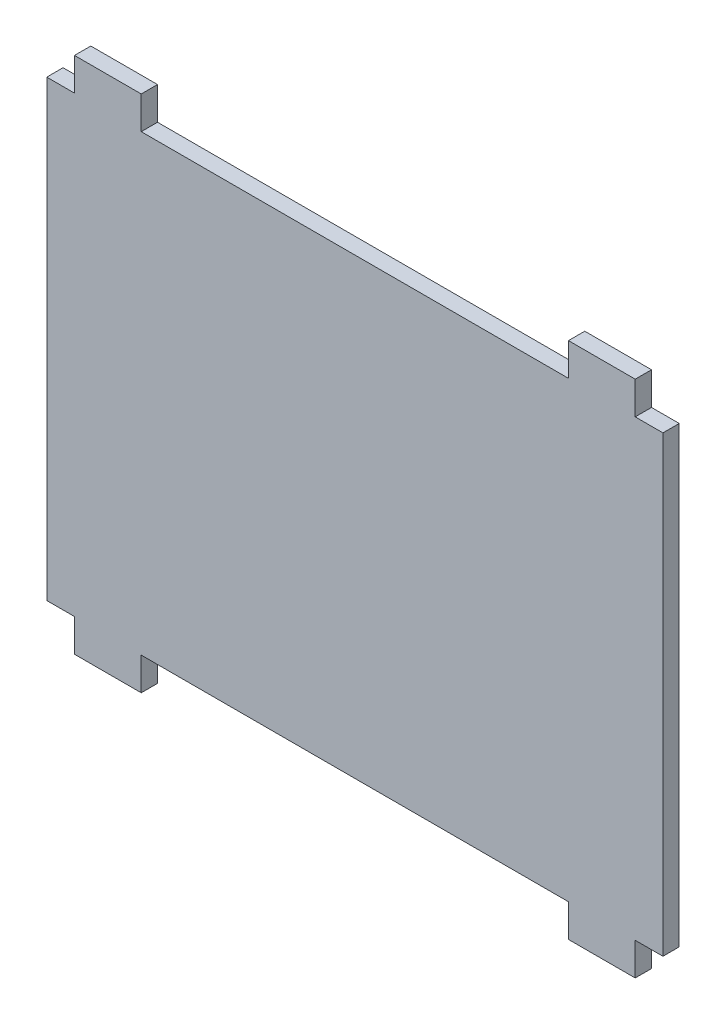
from build123d import *

# Parameters (mm, degrees)
SKETCH1_W           = 60
SKETCH1_H           = 25.25
BOSS_EXTRUDE1_DEPTH = 1.5875
SKETCH2_W           = 41.6
SKETCH2_H           = 3.18
SKETCH2_W_2         = 5.4
CUT_EXTRUDE1_DEPTH  = 1.5875


with BuildPart() as part:
    # Sketch1 → Boss-Extrude1 (new body)
    with BuildSketch(Plane.XY):
        with Locations((0, 12.625)):
            Rectangle(SKETCH1_W, SKETCH1_H)
    boss_extrude1 = extrude(amount=BOSS_EXTRUDE1_DEPTH)

    # Sketch2 → Cut-Extrude1 (cut)
    with BuildSketch(Plane.XY.offset(1.5875)):
        with Locations((0, 23.66)):
            Rectangle(SKETCH2_W, SKETCH2_H)
        with Locations((30, 23.66)):
            Rectangle(SKETCH2_W_2, SKETCH2_H)
        with Locations((-30, 23.66)):
            Rectangle(SKETCH2_W_2, SKETCH2_H)
    cut_extrude1 = extrude(amount=-CUT_EXTRUDE1_DEPTH, mode=Mode.SUBTRACT)

    # Mirror1: Boss-Extrude1, Cut-Extrude1 across plane
    add(boss_extrude1.mirror(Plane.ZX))
    add(cut_extrude1.mirror(Plane.ZX), mode=Mode.SUBTRACT)


solid = part.part
